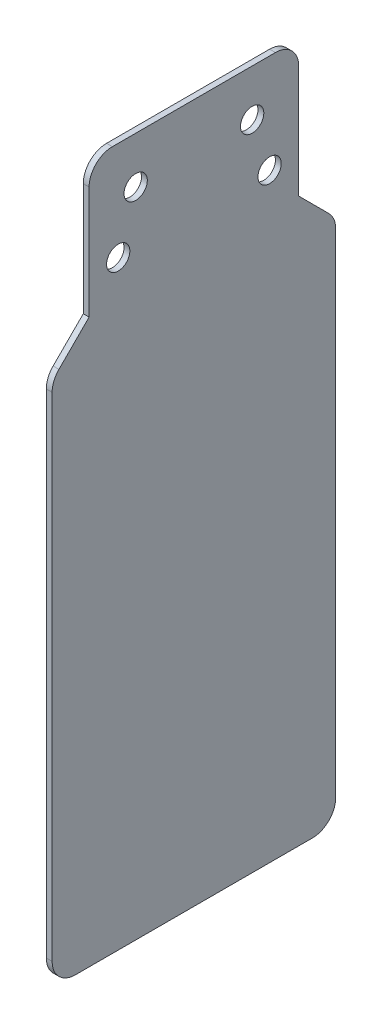
from build123d import *

# Parameters (mm, degrees)
SKETCH1_W                = 36
SKETCH1_H                = 120
BOSS_EXTRUDE1_DEPTH      = 1
F_4_0_4_DIAMETER_HOLE2_D = 4
F_4_0_4_DIAMETER_HOLE3_D = 4
BOSS_EXTRUDE2_DEPTH      = 1
FILLET1_R                = 4


with BuildPart() as part:
    # Sketch1 → Boss-Extrude1 (new body)
    with BuildSketch(Plane(origin=(0, 0, 0), x_dir=(0, 0, -1), z_dir=(1, 0, 0))):
        with Locations((0, -60)):
            Rectangle(SKETCH1_W, SKETCH1_H)
    extrude(amount=BOSS_EXTRUDE1_DEPTH)

    # Ø4.0 (4) Diameter Hole2 (through all)
    with Locations(Plane.ZY):
        with Locations((-10, -8), (10, -8)):
            Hole(F_4_0_4_DIAMETER_HOLE2_D / 2)

    # Ø4.0 (4) Diameter Hole3 (through all)
    with Locations(Plane.ZY):
        with Locations((-13, -17), (13, -17)):
            Hole(F_4_0_4_DIAMETER_HOLE3_D / 2)

    # Sketch9 → Boss-Extrude2 (add)
    with BuildSketch(Plane.ZY):
        with BuildLine():
            Line((18, -23.35), (23.178427125, -28.528427125))
            ThreePointArc((23.178427125, -28.528427125), (24.04551813, -29.82612052), (24.35, -31.356854249))
            Line((24.35, -31.356854249), (24.35, -116))
            ThreePointArc((24.35, -116), (23.178427125, -118.828427125), (20.35, -120))
            Line((20.35, -120), (18, -120))
            Line((18, -120), (18, -23.35))
        make_face()
        with BuildLine():
            Line((-18, -23.35), (-23.178427125, -28.528427125))
            ThreePointArc((-23.178427125, -28.528427125), (-24.04551813, -29.82612052), (-24.35, -31.356854249))
            Line((-24.35, -31.356854249), (-24.35, -116))
            ThreePointArc((-24.35, -116), (-23.178427125, -118.828427125), (-20.35, -120))
            Line((-20.35, -120), (-18, -120))
            Line((-18, -120), (-18, -23.35))
        make_face()
    extrude(amount=-BOSS_EXTRUDE2_DEPTH)

    # Fillet1
    fillet1_edges = [part.edges().sort_by_distance(p)[0] for p in [
        (0.5, 0, 18),
        (0.5, 0, -18),
    ]]
    fillet(fillet1_edges, radius=FILLET1_R)


solid = part.part
